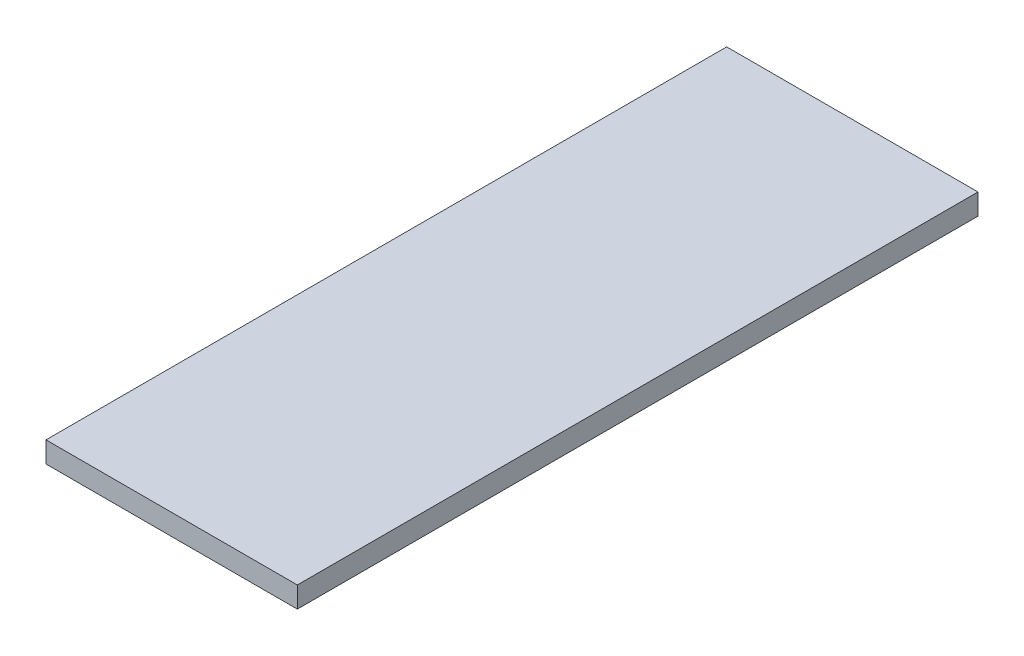
from build123d import *

# Parameters (mm, degrees)
SKETCH_1_W      = 240
SKETCH_1_H      = 650
EXTRUDE_1_DEPTH = 20


with BuildPart() as part:
    # 草图1 → 凸台-拉伸1 (new body)
    with BuildSketch(Plane(origin=(0, 0, 0), x_dir=(1, 0, 0), z_dir=(0, 1, 0))):
        with Locations((120, 325)):
            Rectangle(SKETCH_1_W, SKETCH_1_H)
    extrude(amount=EXTRUDE_1_DEPTH)


solid = part.part
